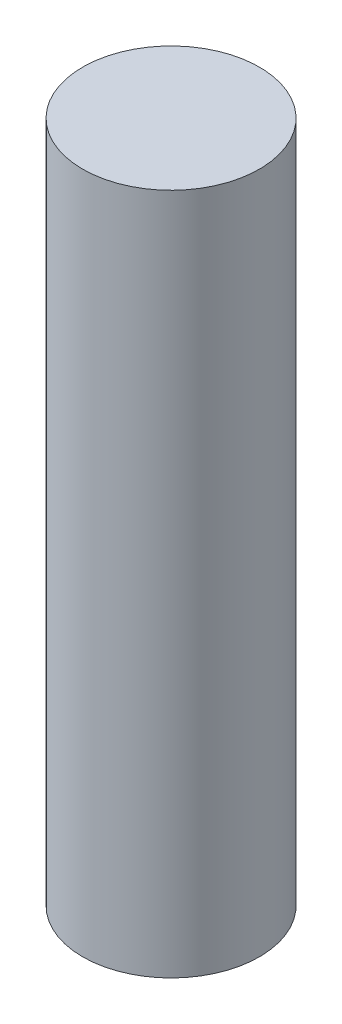
from build123d import *

# Parameters (mm, degrees)
SKETCH1_R           = 3.175
BOSS_EXTRUDE1_DEPTH = 24.5


with BuildPart() as part:
    # Sketch1 → Boss-Extrude1 (new body)
    with BuildSketch(Plane(origin=(0, 0, 0), x_dir=(1, 0, 0), z_dir=(0, 1, 0))):
        with Locations(Location((0, 0, 0), (0, 0, 270))):
            Circle(SKETCH1_R)
    extrude(amount=BOSS_EXTRUDE1_DEPTH)


solid = part.part
